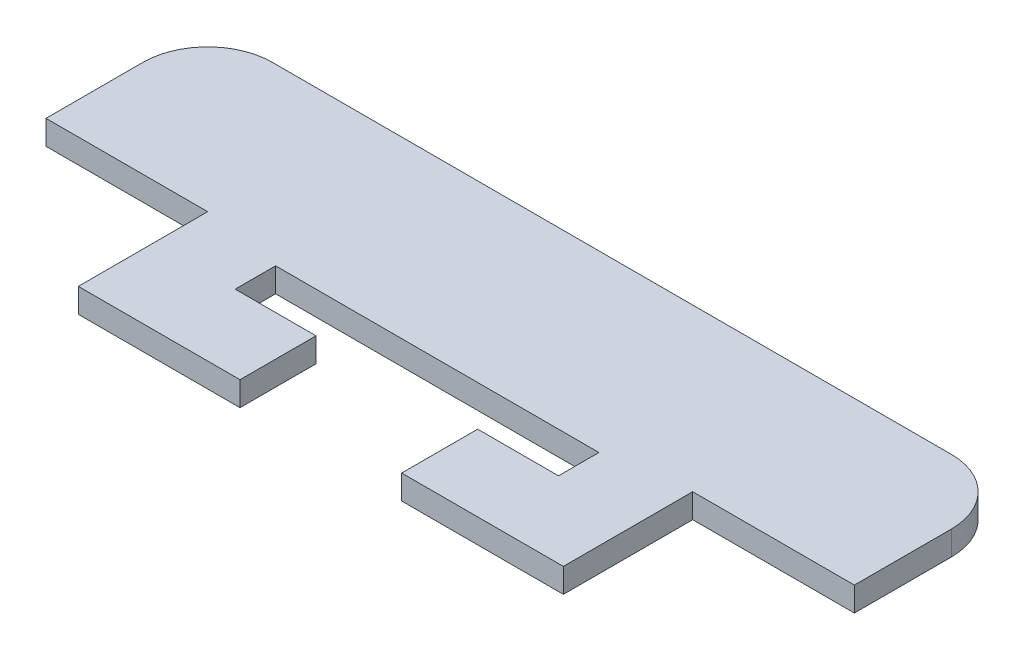
from build123d import *

# Parameters (mm, degrees)
BOSS_EXTRUDE1_DEPTH = 1.905
FILLET1_R           = 5.08
SKETCH2_W           = 12.7
SKETCH2_H           = 5.969
BOSS_EXTRUDE2_DEPTH = 1.905


with BuildPart() as part:
    # Sketch1 → Boss-Extrude1 (new body)
    with BuildSketch(Plane(origin=(0, 0, 0), x_dir=(1, 0, 0), z_dir=(0, 1, 0))):
        Polygon((19.05, 0), (31.75, 0), (31.75, 12.7), (-31.75, 12.7), (-31.75, 0), (-19.05, 0), (-19.05, -10.16), (-12.7, -10.16), (-12.7, -1.016), (12.7, -1.016), (12.7, -10.16), (19.05, -10.16), align=None)
    extrude(amount=BOSS_EXTRUDE1_DEPTH)

    # Fillet1
    fillet1_edges = [part.edges().sort_by_distance(p)[0] for p in [
        (-31.75, 0.9525, -12.7),
        (31.75, 0.9525, -12.7),
    ]]
    fillet(fillet1_edges, radius=FILLET1_R)

    # Sketch2 → Boss-Extrude2 (add)
    with BuildSketch(Plane(origin=(0, 1.905, 0), x_dir=(1, 0, 0), z_dir=(0, 1, 0))):
        with Locations((-12.7, -7.1755)):
            Rectangle(SKETCH2_W, SKETCH2_H)
        with Locations((12.7, -7.1755)):
            Rectangle(SKETCH2_W, SKETCH2_H)
    extrude(amount=-BOSS_EXTRUDE2_DEPTH)


solid = part.part
